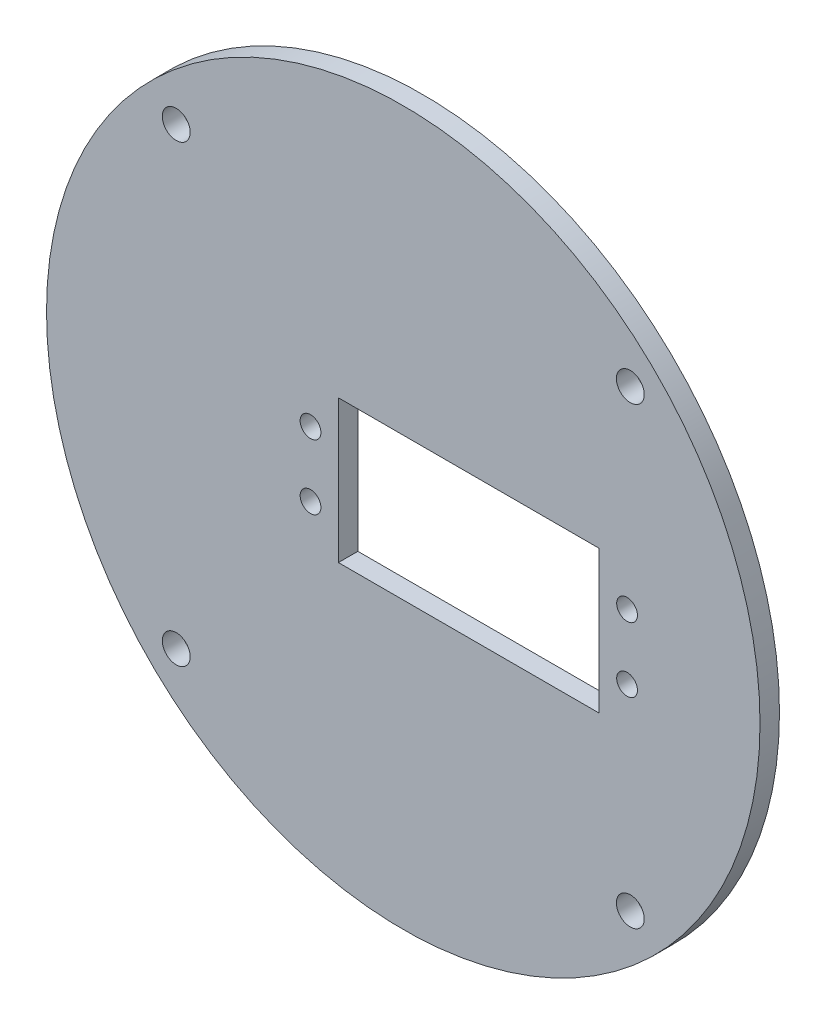
from build123d import *

# Parameters (mm, degrees)
SKETCH_1_R      = 55
SKETCH_1_R_2    = 2.15
SKETCH_1_R_3    = 1.6
SKETCH_1_W      = 40.2
SKETCH_1_H      = 22
EXTRUDE_2_DEPTH = 3


with BuildPart() as part:
    # 草图1 → 凸台-拉伸2 (new body)
    with BuildSketch(Plane.XY):
        Circle(SKETCH_1_R)
        with Locations((-35.001785669, 35.001785669)):
            Circle(SKETCH_1_R_2, mode=Mode.SUBTRACT)
        with Locations((35.001785669, 35.001785669)):
            Circle(SKETCH_1_R_2, mode=Mode.SUBTRACT)
        with Locations((35.001785669, -35.001785669)):
            Circle(SKETCH_1_R_2, mode=Mode.SUBTRACT)
        with Locations((-35.001785669, -35.001785669)):
            Circle(SKETCH_1_R_2, mode=Mode.SUBTRACT)
        with Locations((-14.3, 5)):
            Circle(SKETCH_1_R_3, mode=Mode.SUBTRACT)
        with Locations((-14.3, -5)):
            Circle(SKETCH_1_R_3, mode=Mode.SUBTRACT)
        with Locations((34.5, 5)):
            Circle(SKETCH_1_R_3, mode=Mode.SUBTRACT)
        with Locations((34.5, -5)):
            Circle(SKETCH_1_R_3, mode=Mode.SUBTRACT)
        with Locations((10.1, 0)):
            Rectangle(SKETCH_1_W, SKETCH_1_H, mode=Mode.SUBTRACT)
    extrude(amount=EXTRUDE_2_DEPTH)


solid = part.part
